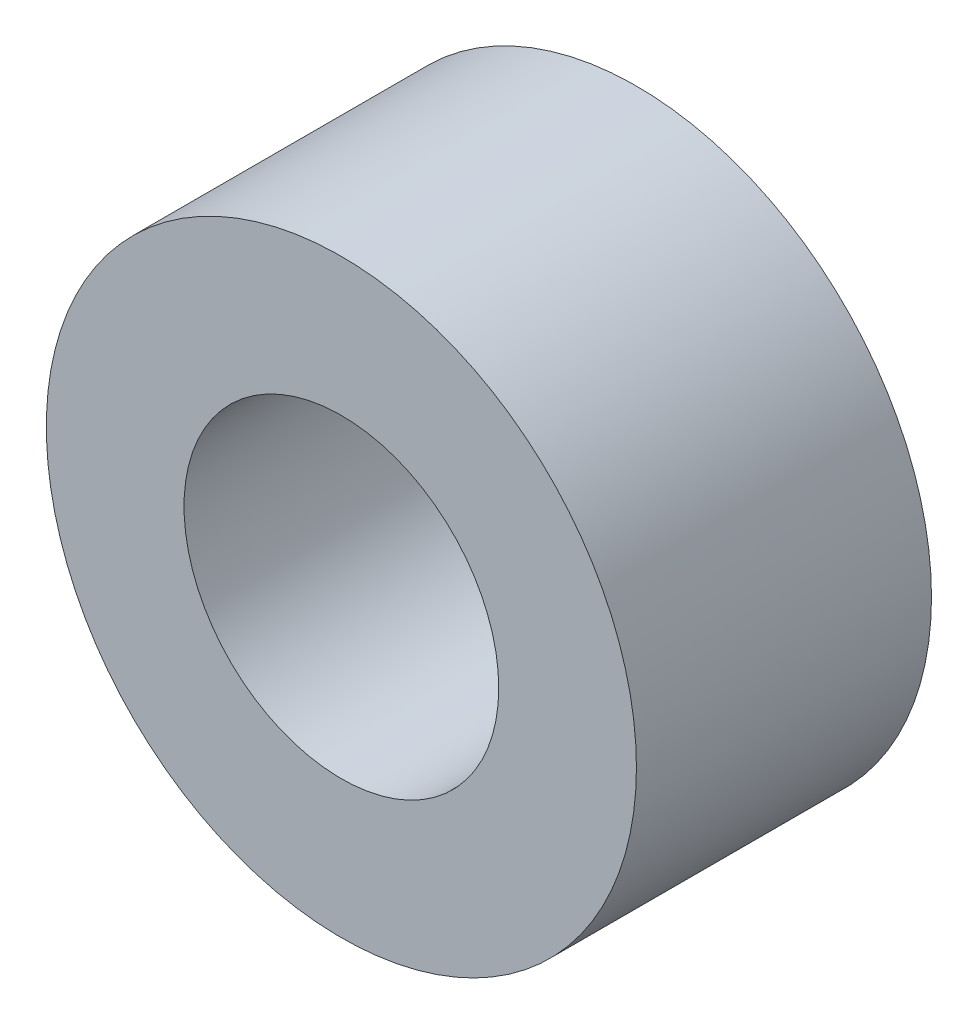
from build123d import *

# Parameters (mm, degrees)
SKETCH_1_R          = 3
SKETCH_1_R_2        = 1.6
EXTRUDE_3P2_6_DEPTH = 3


with BuildPart() as part:
    # 草图1 → 隔套_内径3p2外径6 (new body)
    with BuildSketch(Plane.XY):
        Circle(SKETCH_1_R)
        Circle(SKETCH_1_R_2, mode=Mode.SUBTRACT)
    extrude(amount=EXTRUDE_3P2_6_DEPTH)


solid = part.part
